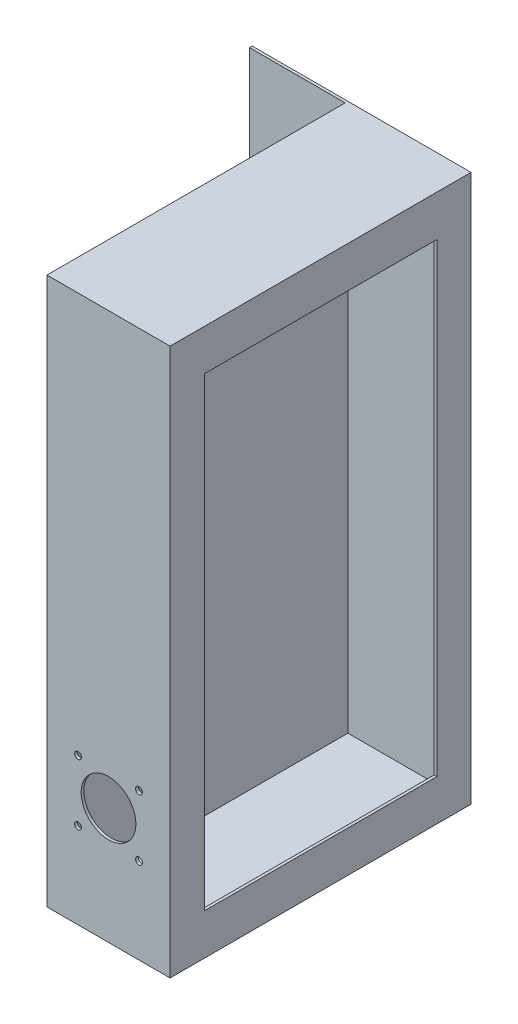
from build123d import *

# Parameters (mm, degrees)
SKETCH1_W           = 90
SKETCH1_H           = 400
BOSS_EXTRUDE1_DEPTH = 110
SHELL1_T            = 2
CUT_EXTRUDE2_REACH  = 247.357
SKETCH2_W           = 170
SKETCH2_H           = 340
CUT_EXTRUDE3_REACH  = 302.707
SKETCH5_R           = 20
SKETCH5_R_2         = 2.5
SKETCH6_W           = 70
SKETCH6_H           = 400
BOSS_EXTRUDE2_DEPTH = 2


with BuildPart() as part:
    # Sketch1 → Boss-Extrude1 (new, symmetric)
    with BuildSketch(Plane.XY):
        Rectangle(SKETCH1_W, SKETCH1_H)
    extrude(amount=BOSS_EXTRUDE1_DEPTH, both=True)

    # Shell1 (no face opened: a closed hollow body)
    add(offset(amount=-SHELL1_T, mode=Mode.PRIVATE), mode=Mode.SUBTRACT)

    # Sketch2 → Cut-Extrude2 (cut, up to next)
    with BuildSketch(Plane(origin=(45, 0, 0), x_dir=(0, 0, -1), z_dir=(1, 0, 0)), mode=Mode.PRIVATE) as cut_extrude2_sk1:
        Rectangle(SKETCH2_W, SKETCH2_H)
    cut_extrude2_tool1 = extrude(cut_extrude2_sk1.sketch, amount=-CUT_EXTRUDE2_REACH, mode=Mode.PRIVATE) & part.part
    add(cut_extrude2_tool1.solids().sort_by_distance((45, 0, 0))[0], mode=Mode.SUBTRACT)

    # Sketch5 → Cut-Extrude3 (cut, up to next)
    with BuildSketch(Plane.XY.offset(110), mode=Mode.PRIVATE) as cut_extrude3_sk1:
        with Locations((0, -115)):
            Circle(SKETCH5_R)
    cut_extrude3_tool1 = extrude(cut_extrude3_sk1.sketch, amount=-CUT_EXTRUDE3_REACH, mode=Mode.PRIVATE) & part.part
    # Sketch5 → Cut-Extrude3 (cut, up to next)
    with BuildSketch(Plane.XY.offset(110), mode=Mode.PRIVATE) as cut_extrude3_sk2:
        with Locations((-22.275, -92.725)):
            Circle(SKETCH5_R_2)
    cut_extrude3_tool2 = extrude(cut_extrude3_sk2.sketch, amount=-CUT_EXTRUDE3_REACH, mode=Mode.PRIVATE) & part.part
    # Sketch5 → Cut-Extrude3 (cut, up to next)
    with BuildSketch(Plane.XY.offset(110), mode=Mode.PRIVATE) as cut_extrude3_sk3:
        with Locations((22.275, -92.725)):
            Circle(SKETCH5_R_2)
    cut_extrude3_tool3 = extrude(cut_extrude3_sk3.sketch, amount=-CUT_EXTRUDE3_REACH, mode=Mode.PRIVATE) & part.part
    # Sketch5 → Cut-Extrude3 (cut, up to next)
    with BuildSketch(Plane.XY.offset(110), mode=Mode.PRIVATE) as cut_extrude3_sk4:
        with Locations((-22.275, -137.275)):
            Circle(SKETCH5_R_2)
    cut_extrude3_tool4 = extrude(cut_extrude3_sk4.sketch, amount=-CUT_EXTRUDE3_REACH, mode=Mode.PRIVATE) & part.part
    # Sketch5 → Cut-Extrude3 (cut, up to next)
    with BuildSketch(Plane.XY.offset(110), mode=Mode.PRIVATE) as cut_extrude3_sk5:
        with Locations((22.275, -137.275)):
            Circle(SKETCH5_R_2)
    cut_extrude3_tool5 = extrude(cut_extrude3_sk5.sketch, amount=-CUT_EXTRUDE3_REACH, mode=Mode.PRIVATE) & part.part
    add(cut_extrude3_tool1.solids().sort_by_distance((0, -115, 110))[0], mode=Mode.SUBTRACT)
    add(cut_extrude3_tool2.solids().sort_by_distance((-22.275, -92.725, 110))[0], mode=Mode.SUBTRACT)
    add(cut_extrude3_tool3.solids().sort_by_distance((22.275, -92.725, 110))[0], mode=Mode.SUBTRACT)
    add(cut_extrude3_tool4.solids().sort_by_distance((-22.275, -137.275, 110))[0], mode=Mode.SUBTRACT)
    add(cut_extrude3_tool5.solids().sort_by_distance((22.275, -137.275, 110))[0], mode=Mode.SUBTRACT)

    # Sketch6 → Boss-Extrude2 (add)
    with BuildSketch(Plane(origin=(0, 0, -110), x_dir=(-1, 0, 0), z_dir=(0, 0, -1))):
        with Locations((80, 0)):
            Rectangle(SKETCH6_W, SKETCH6_H)
    extrude(amount=-BOSS_EXTRUDE2_DEPTH)


solid = part.part
